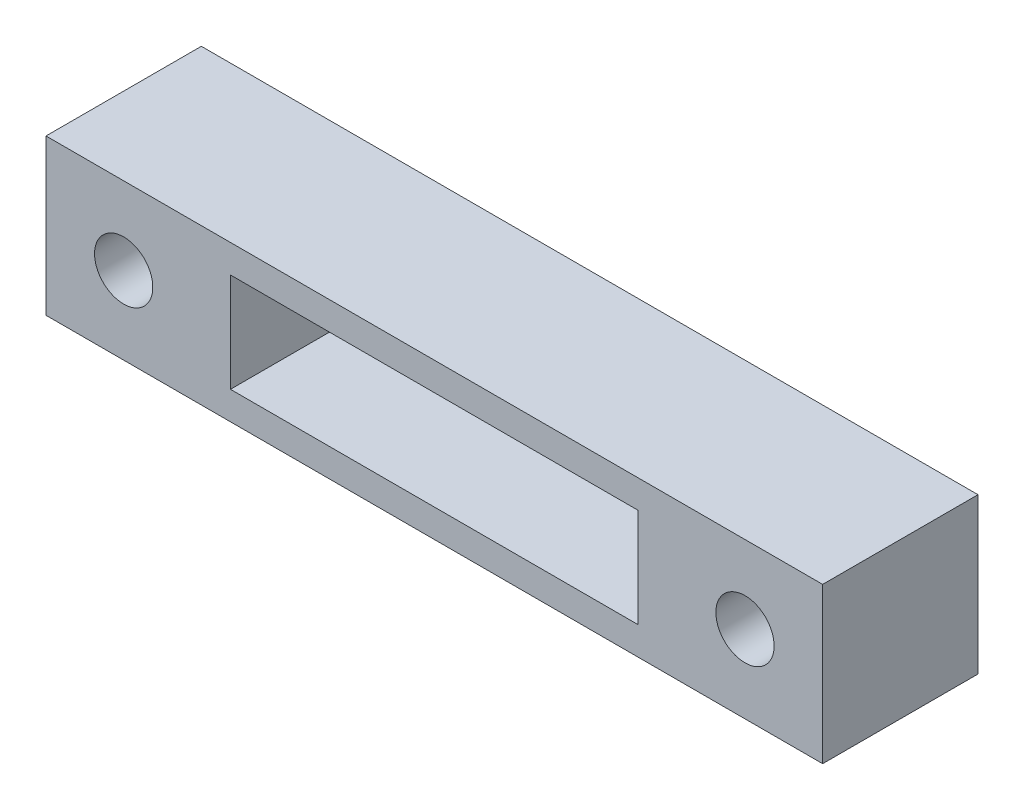
from build123d import *

# Parameters (mm, degrees)
SKETCH1_W           = 21
SKETCH1_H           = 5.5
BOSS_EXTRUDE1_DEPTH = 8
SKETCH2_W           = 21
SKETCH2_H           = 5.1
CUT_EXTRUDE1_DEPTH  = 5.5
SKETCH3_R           = 1.5
CUT_EXTRUDE2_DEPTH  = 10


with BuildPart() as part:
    # Sketch1 → Boss-Extrude1 (new body)
    with BuildSketch(Plane(origin=(0, 0, 0), x_dir=(1, 0, 0), z_dir=(0, 1, 0))):
        Polygon((-20, 20), (-20, 12), (-10.5, 12), (-10.5, 17.5), (10.5, 17.5), (10.5, 12), (20, 12), (20, 20), align=None)
        with Locations((0, 14.75)):
            Rectangle(SKETCH1_W, SKETCH1_H)
    extrude(amount=BOSS_EXTRUDE1_DEPTH)

    # Sketch2 → Cut-Extrude1 (cut)
    with BuildSketch(Plane.XY.offset(-12)):
        with Locations((0, 4)):
            Rectangle(SKETCH2_W, SKETCH2_H)
    extrude(amount=-CUT_EXTRUDE1_DEPTH, mode=Mode.SUBTRACT)

    # Sketch3 → Cut-Extrude2 (cut)
    with BuildSketch(Plane(origin=(0, 0, -20), x_dir=(-1, 0, 0), z_dir=(0, 0, -1))):
        with Locations((-16, 4)):
            Circle(SKETCH3_R)
        with Locations((16, 4)):
            Circle(SKETCH3_R)
    extrude(amount=-CUT_EXTRUDE2_DEPTH, mode=Mode.SUBTRACT)


solid = part.part
